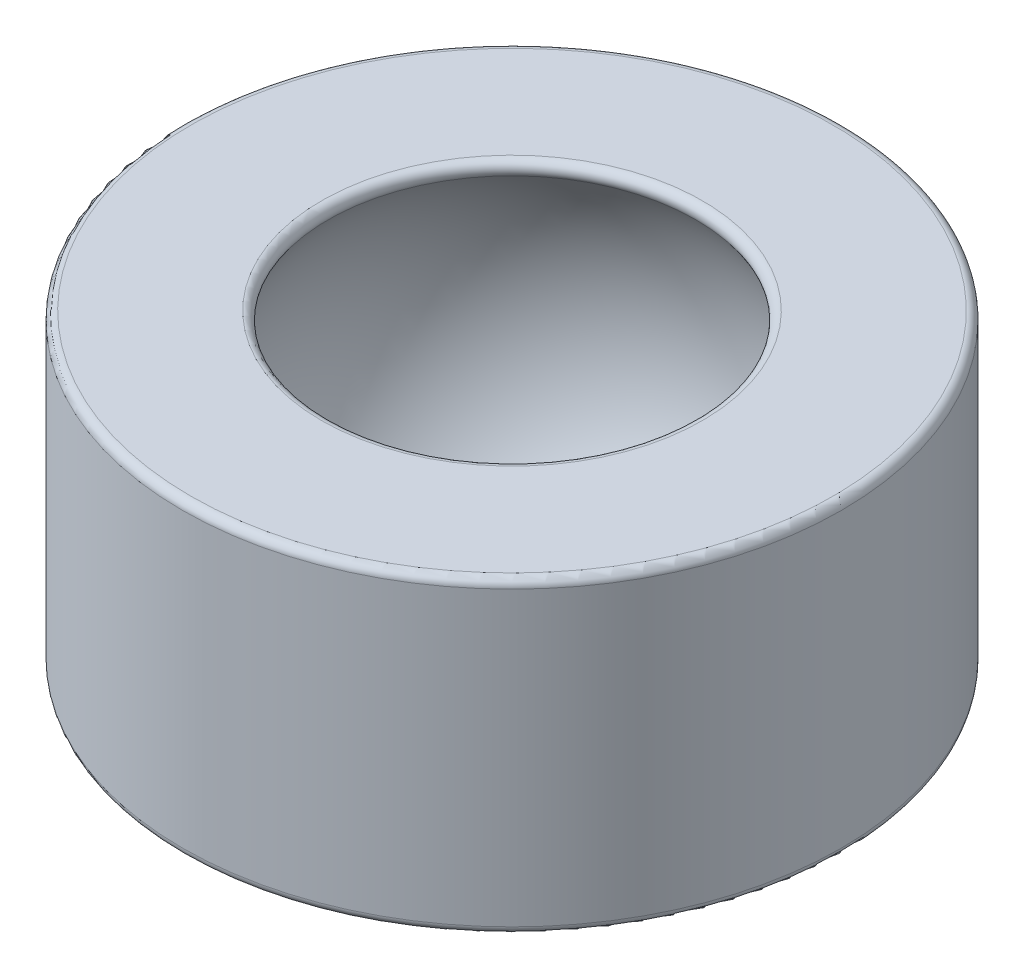
from build123d import *

# Parameters (mm, degrees)
BOSS_EXTRUDE1_DEPTH      = 1.875
BOSS_EXTRUDE1_DEPTH_BACK = 1.875
SKETCH2_R                = 4
SKETCH2_R_2              = 2
FILLET1_R                = 0.1


with BuildPart() as part:
    # Sketch2 → Boss-Extrude1 (new, two sides: drawn at the far end of the back side and taken through both)
    with BuildSketch(Plane(origin=(0, 0, 0), x_dir=(1, 0, 0), z_dir=(0, 1, 0)).offset(-BOSS_EXTRUDE1_DEPTH_BACK)):
        Circle(SKETCH2_R)
        Circle(SKETCH2_R_2, mode=Mode.SUBTRACT)
    extrude(amount=BOSS_EXTRUDE1_DEPTH + BOSS_EXTRUDE1_DEPTH_BACK)


with BuildPart() as body_2:
    # Sketch4 → Revolve1 (revolve)
    with BuildSketch(Plane(origin=(0, 0, 0), x_dir=(1, 0, 0), z_dir=(0, 1, 0))):
        with BuildLine():
            Line((0, 2.81470199), (0, -2.81470199))
            ThreePointArc((0, -2.81470199), (-2.81470199, 0), (0, 2.81470199))
        make_face()
    revolve(axis=Axis((0, 0, -2.81470199), (0, 0, 1)))


with BuildPart() as part_1:
    add(part.part)

    # Combine2: cut body 2
    add(body_2.part, mode=Mode.SUBTRACT)

    # Fillet1
    fillet1_edges = [part_1.edges().sort_by_distance(p)[0] for p in [
        (-4, -1.875, 0),
        (-4, 1.875, 0),
        (0, -1.875, -2.099267085),
        (0, 1.875, -2.099267085),
    ]]
    fillet(fillet1_edges, radius=FILLET1_R)


solid = part_1.part
